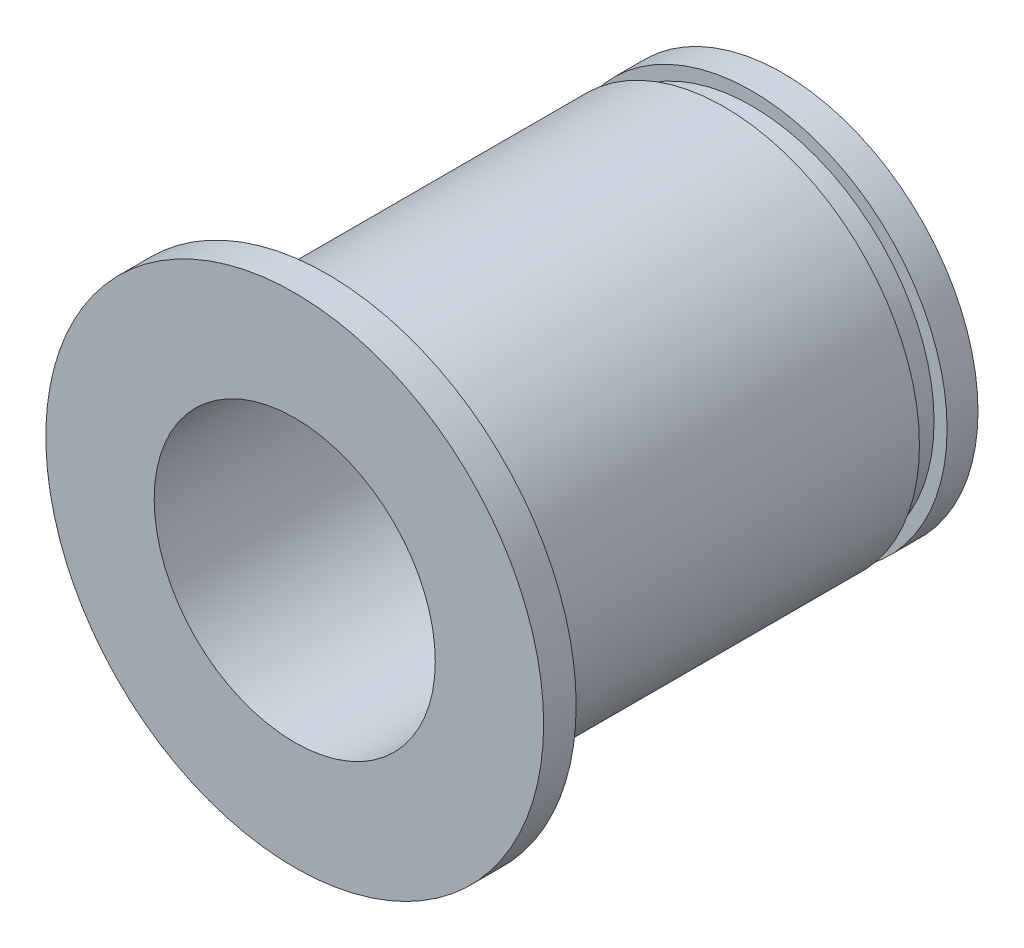
from build123d import *

# Parameters (mm, degrees)
F_01_START                                = -2
S01_GROUND_GUIDE_BORE_AND_BODY_R          = 6
S01_GROUND_GUIDE_BORE_AND_BODY_R_2        = 4.32
F_01_GROUND_GUIDE_BORE_AND_BODY_DEPTH     = 14
F_02_START                                = 12
S02_OUTBOARD_FLANGE_R                     = 7.65
S02_OUTBOARD_FLANGE_R_2                   = 4.32
F_02_OUTBOARD_FLANGE_DEPTH                = 1
F_03_START                                = -1.05
S03_EXTERNAL_RETAINING_RING_GROOVE_R      = 6.1
S03_EXTERNAL_RETAINING_RING_GROOVE_R_2    = 5.6
F_03_EXTERNAL_RETAINING_RING_GROOVE_DEPTH = 0.85


with BuildPart() as part:
    # S01 - Ground guide bore and body → 01 - Ground guide bore and body (new body)
    with BuildSketch(Plane.XY.offset(F_01_START)):
        Circle(S01_GROUND_GUIDE_BORE_AND_BODY_R)
        Circle(S01_GROUND_GUIDE_BORE_AND_BODY_R_2, mode=Mode.SUBTRACT)
    extrude(amount=F_01_GROUND_GUIDE_BORE_AND_BODY_DEPTH)

    # S02 - Outboard flange → 02 - Outboard flange (add)
    with BuildSketch(Plane.XY.offset(F_02_START)):
        Circle(S02_OUTBOARD_FLANGE_R)
        Circle(S02_OUTBOARD_FLANGE_R_2, mode=Mode.SUBTRACT)
    extrude(amount=F_02_OUTBOARD_FLANGE_DEPTH)

    # S03 - External retaining ring groove → 03 - External retaining ring groove (cut)
    with BuildSketch(Plane.XY.offset(F_03_START)):
        Circle(S03_EXTERNAL_RETAINING_RING_GROOVE_R)
        Circle(S03_EXTERNAL_RETAINING_RING_GROOVE_R_2, mode=Mode.SUBTRACT)
    extrude(amount=F_03_EXTERNAL_RETAINING_RING_GROOVE_DEPTH, mode=Mode.SUBTRACT)


solid = part.part
